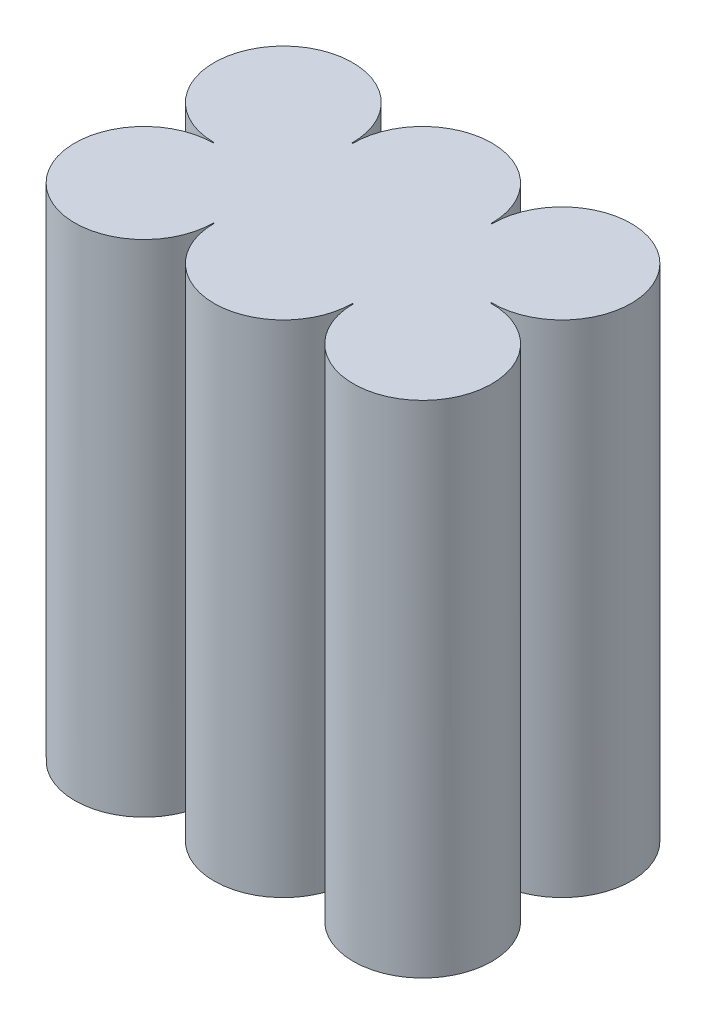
from build123d import *

# Parameters (mm, degrees)
CROQUIS1_R              = 9
SALIENTE_EXTRUIR1_DEPTH = 65
CROQUIS2_W              = 36
CROQUIS2_H              = 18
SALIENTE_EXTRUIR2_DEPTH = 10
MATRIZL1_COUNT          = 3
MATRIZL1_PITCH          = 18.1
MATRIZL1_COUNT_DIR2     = 2
MATRIZL1_PITCH_DIR2     = 18.1


with BuildPart() as part:
    # Croquis1 → Saliente-Extruir1 (new body)
    with BuildSketch(Plane(origin=(0, 0, 0), x_dir=(1, 0, 0), z_dir=(0, 1, 0))):
        with Locations(Location((0, 0, 0), (0, 0, 270))):
            Circle(CROQUIS1_R)
    saliente_extruir1 = extrude(amount=SALIENTE_EXTRUIR1_DEPTH)

    # Croquis2 → Saliente-Extruir2 (add)
    with BuildSketch(Plane(origin=(0, 65, 0), x_dir=(1, 0, 0), z_dir=(0, 1, 0))):
        with Locations((18, 9)):
            Rectangle(CROQUIS2_W, CROQUIS2_H)
    extrude(amount=-SALIENTE_EXTRUIR2_DEPTH)

    # MatrizL1: Saliente-Extruir1 3 × 2
    with Locations(*[(i * MATRIZL1_PITCH, 0, -j * MATRIZL1_PITCH_DIR2) for i in range(MATRIZL1_COUNT) for j in range(MATRIZL1_COUNT_DIR2) if (i, j) != (0, 0)]):
        add(saliente_extruir1)


solid = part.part
